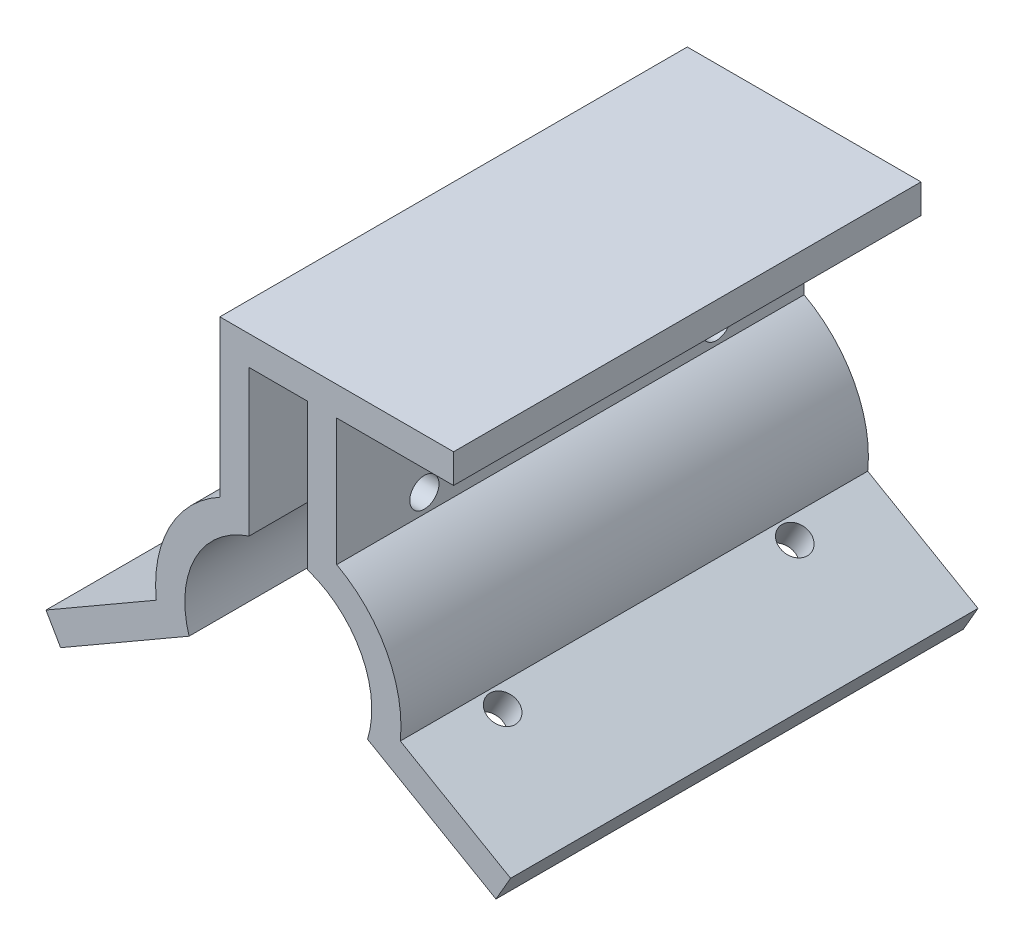
from build123d import *

# Parameters (mm, degrees)
BOSS_EXTRUDE1_DEPTH            = 80
F_5_0MM_DOWEL_HOLE1_AT_2_COUNT = 2
F_5_0MM_DOWEL_HOLE1_AT_2_PITCH = 50
SKETCH5_W                      = 2.5
SKETCH5_H                      = 34.757041555
F_5_0MM_DOWEL_HOLE2_AT_2_COUNT = 2
F_5_0MM_DOWEL_HOLE2_AT_2_PITCH = 50
MIRROR2_COPY_1_SKETCH_W        = 2.5
MIRROR2_COPY_1_SKETCH_H        = 34.757041555


with BuildPart() as part:
    # Sketch1 → Boss-Extrude1 (new body)
    with BuildSketch(Plane.XY):
        with BuildLine():
            Line((-5, 15.198684154), (-5, 40.198684154))
            Line((-5, 40.198684154), (5, 40.198684154))
            Line((5, 40.198684154), (5, 15.198684154))
            ThreePointArc((5, 15.198684154), (14.229023395, 7.316754283), (15.270817283, -4.775158585))
            Line((15.270817283, -4.775158585), (37.257041555, -17.468911087))
            Line((37.257041555, -17.468911087), (39.757041555, -13.138784068))
            Line((39.757041555, -13.138784068), (20.88016837, -2.240216253))
            ThreePointArc((20.88016837, -2.240216253), (18.589915709, 9.768061933), (10, 18.466185313))
            Line((10, 18.466185313), (10, 40.198684154))
            Line((10, 40.198684154), (30, 40.198684154))
            Line((30, 40.198684154), (30, 45.198684154))
            Line((30, 45.198684154), (-10, 45.198684154))
            Line((-10, 45.198684154), (-10, 18.466185313))
            ThreePointArc((-10, 18.466185313), (-18.589915709, 9.768061933), (-20.88016837, -2.240216253))
            Line((-20.88016837, -2.240216253), (-39.757041555, -13.138784068))
            Line((-39.757041555, -13.138784068), (-37.257041555, -17.468911087))
            Line((-37.257041555, -17.468911087), (-15.270817283, -4.775158585))
            ThreePointArc((-15.270817283, -4.775158585), (-14.229023395, 7.316754283), (-5, 15.198684154))
        make_face()
    extrude(amount=BOSS_EXTRUDE1_DEPTH)

    # Sketch3 → Ø5.0mm Dowel Hole1 (revolve, cut)
    with BuildSketch(Plane(origin=(20.899982408, -8.025158585, 65), x_dir=(0.866025403784438, -0.5000000000000012, 0), z_dir=(0, 0, 1))):
        Polygon((0, 0), (0, 11.502151548), (2.5, 10), (2.5, 0), align=None)
    f_5_0mm_dowel_hole1 = revolve(axis=Axis((17.724982408, -13.524419899, 65), (0.5000000000000012, 0.8660254037844379, 0)), mode=Mode.SUBTRACT)

    # Ø5.0mm Dowel Hole1 at 2: Ø5.0mm Dowel Hole1 ×2
    with Locations(*[(0, 0, -i * F_5_0MM_DOWEL_HOLE1_AT_2_PITCH) for i in range(1, F_5_0MM_DOWEL_HOLE1_AT_2_COUNT)]):
        add(f_5_0mm_dowel_hole1, mode=Mode.SUBTRACT)

    # Mirror1: Ø5.0mm Dowel Hole1 across plane
    add(f_5_0mm_dowel_hole1.mirror(Plane(origin=(0, 0, 0), x_dir=(0, 0, 1), z_dir=(1, 0, 0))), mode=Mode.SUBTRACT)

    # Mirror1 copy 1 sketch → Mirror1 copy 1 (revolve, cut)
    with BuildSketch(Plane(origin=(-20.899982408, -8.025158585, 15), x_dir=(-0.866025403784438, -0.5000000000000012, 0), z_dir=(0, 0, 1))):
        Polygon((0, 0), (0, -11.502151548), (2.5, -10), (2.5, 0), align=None)
    revolve(axis=Axis((-17.724982408, -13.524419899, 15), (0.5000000000000012, -0.8660254037844379, 0)), mode=Mode.SUBTRACT)

    # Sketch5 → Ø5.0mm Dowel Hole2 (revolve, cut)
    with BuildSketch(Plane(origin=(-5, 21.698684154, 15), x_dir=(0, 0, -1), z_dir=(0, 1, 0))):
        with Locations((1.25, 17.378520778)):
            Rectangle(SKETCH5_W, SKETCH5_H)
    f_5_0mm_dowel_hole2 = revolve(axis=Axis((1.35, 21.698684154, 15), (-1, 0, 0)), mode=Mode.SUBTRACT)

    # Ø5.0mm Dowel Hole2 at 2: Ø5.0mm Dowel Hole2 ×2
    with Locations(*[(0, 0, i * F_5_0MM_DOWEL_HOLE2_AT_2_PITCH) for i in range(1, F_5_0MM_DOWEL_HOLE2_AT_2_COUNT)]):
        add(f_5_0mm_dowel_hole2, mode=Mode.SUBTRACT)

    # Mirror2: Ø5.0mm Dowel Hole2 across plane
    add(f_5_0mm_dowel_hole2.mirror(Plane(origin=(0, 0, 0), x_dir=(0, 0, 1), z_dir=(1, 0, 0))), mode=Mode.SUBTRACT)

    # Mirror2 copy 1 sketch → Mirror2 copy 1 (revolve, cut)
    with BuildSketch(Plane(origin=(5, 21.698684154, 65), x_dir=(0, 0, -1), z_dir=(0, 1, 0))):
        with Locations((1.25, -17.378520778)):
            Rectangle(MIRROR2_COPY_1_SKETCH_W, MIRROR2_COPY_1_SKETCH_H)
    revolve(axis=Axis((-1.35, 21.698684154, 65), (-1, 0, 0)), mode=Mode.SUBTRACT)


solid = part.part
